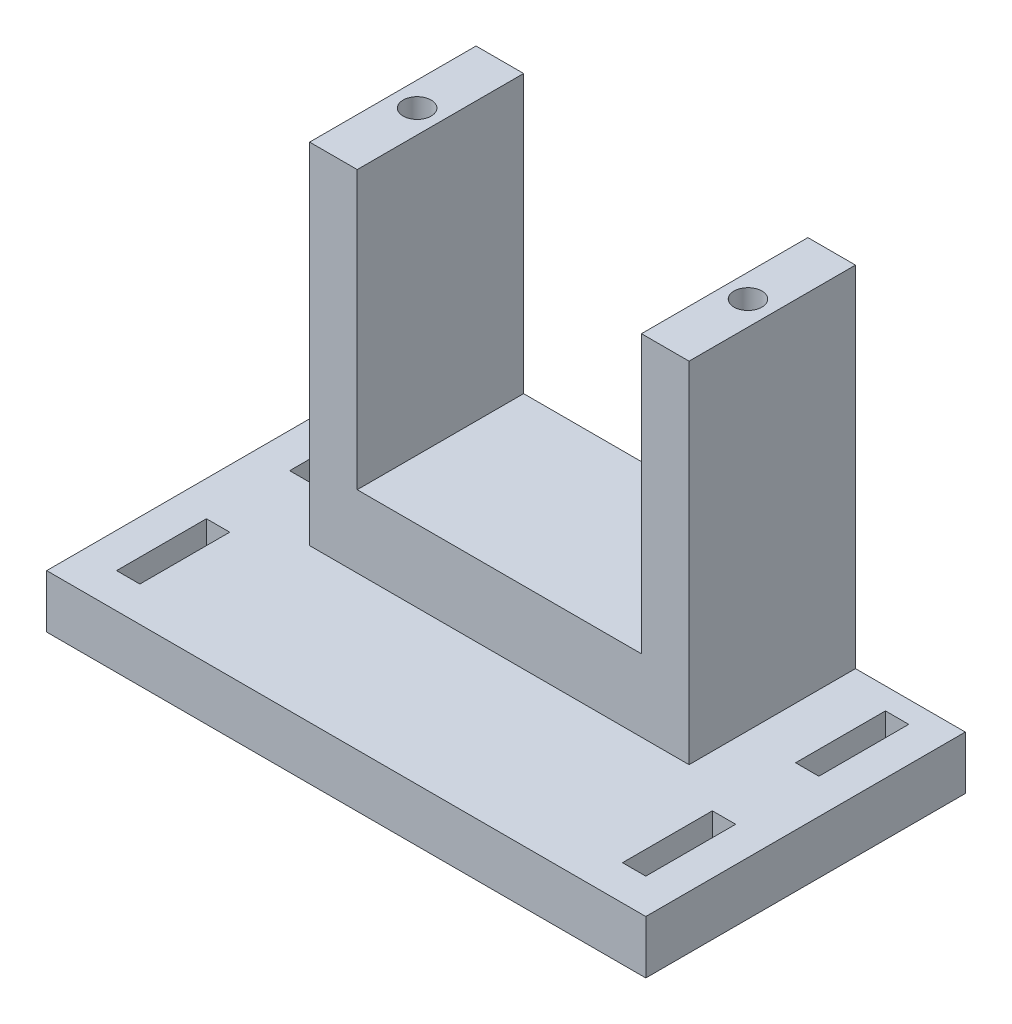
from build123d import *

# Parameters (mm, degrees)
SKETCH1_W            = 57
SKETCH1_H            = 60.5
BOSS_EXTRUDE1_DEPTH  = 25
SKETCH2_W            = 42.7
SKETCH2_H            = 43.793176539
CUT_EXTRUDE1_DEPTH   = 72.396778639
SKETCH3_W            = 90
SKETCH3_H            = 48
BOSS_EXTRUDE2_DEPTH  = 8
SKETCH4_W            = 3.5
SKETCH4_H            = 13.5
CUT_EXTRUDE2_DEPTH   = 85.17392708
LPATTERN1_COUNT      = 2
LPATTERN1_PITCH      = 76
LPATTERN1_COUNT_DIR2 = 2
LPATTERN1_PITCH_DIR2 = 26
SKETCH5_R            = 2.1
CUT_EXTRUDE3_DEPTH   = 8


with BuildPart() as part:
    # Sketch1 → Boss-Extrude1 (new body)
    with BuildSketch(Plane.XY):
        with Locations((0, 30.25)):
            Rectangle(SKETCH1_W, SKETCH1_H)
    extrude(amount=BOSS_EXTRUDE1_DEPTH)

    # Sketch2 → Cut-Extrude1 (cut, through all)
    with BuildSketch(Plane.XY.offset(25)):
        with Locations((0, 40.74658827)):
            Rectangle(SKETCH2_W, SKETCH2_H)
    extrude(amount=-CUT_EXTRUDE1_DEPTH, mode=Mode.SUBTRACT)

    # Sketch3 → Boss-Extrude2 (add)
    with BuildSketch(Plane(origin=(0, 0, 0), x_dir=(1, 0, 0), z_dir=(0, 1, 0))):
        with Locations((0, -24)):
            Rectangle(SKETCH3_W, SKETCH3_H)
    extrude(amount=BOSS_EXTRUDE2_DEPTH)

    # Sketch4 → Cut-Extrude2 (cut, through all)
    with BuildSketch(Plane(origin=(0, 8, 0), x_dir=(1, 0, 0), z_dir=(0, 1, 0))):
        with Locations((-38, -10)):
            Rectangle(SKETCH4_W, SKETCH4_H)
    cut_extrude2 = extrude(amount=-CUT_EXTRUDE2_DEPTH, mode=Mode.SUBTRACT)

    # LPattern1: Cut-Extrude2 2 × 2
    with Locations(*[(i * LPATTERN1_PITCH, 0, j * LPATTERN1_PITCH_DIR2) for i in range(LPATTERN1_COUNT) for j in range(LPATTERN1_COUNT_DIR2) if (i, j) != (0, 0)]):
        add(cut_extrude2, mode=Mode.SUBTRACT)

    # Sketch5 → Cut-Extrude3 (cut)
    with BuildSketch(Plane(origin=(0, 60.5, 0), x_dir=(1, 0, 0), z_dir=(0, 1, 0))):
        with Locations(Location((-24.85, -12.5, 0), (0, 0, 270))):
            Circle(SKETCH5_R)
        with Locations(Location((24.85, -12.5, 0), (0, 0, 270))):
            Circle(SKETCH5_R)
    extrude(amount=-CUT_EXTRUDE3_DEPTH, mode=Mode.SUBTRACT)


solid = part.part
